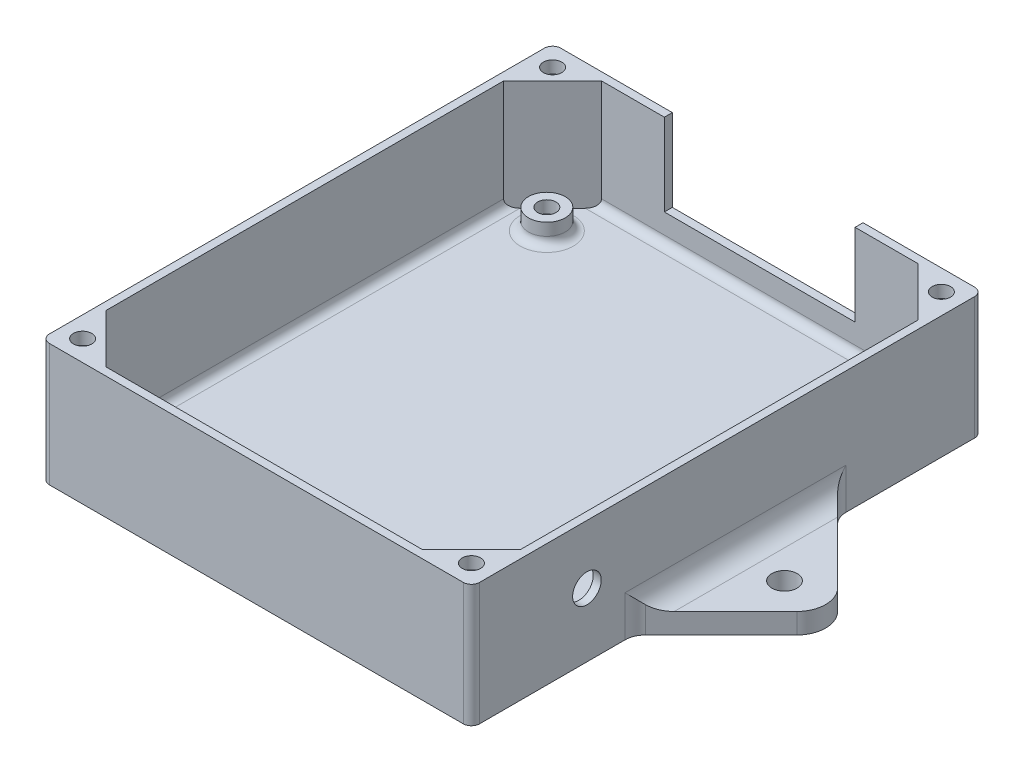
from build123d import *

# Parameters (mm, degrees)
ESQUISSE2_W              = 105.34
ESQUISSE2_H              = 125.21
ESQUISSE2_W_2            = 101.44
ESQUISSE2_H_2            = 121.31
BASE_DEPTH               = 3
ESQUISSE3_R              = 4.5
SUPPORT_PCB_DEPTH        = 5
ESQUISSE4_R              = 2.25
ESQUISSE4_R_2            = 1.5
INSERT_M3_PCB_DEPTH      = 3
ESQUISSE4_3_R            = 1.5
PASSAGE_M3_PCB_DEPTH     = 5
ESQUISSE2_4_W            = 105.34
ESQUISSE2_4_H            = 125.21
ESQUISSE2_4_W_2          = 101.44
ESQUISSE2_4_H_2          = 121.31
WALLS_DEPTH              = 27
OUVERTURE_CONN_CMC_REACH = 140.494
ESQUISSE5_W              = 46.7
ESQUISSE5_H              = 20.1
CHANFREIN1_SIZE          = 12
CONG_1_R                 = 2
ESQUISSE6_R              = 2.25
INSERT_M3_BOX_DEPTH      = 3
ESQUISSE6_3_R            = 1.6
PASSAGE_M3_BOX_DEPTH     = 18
ESQUISSE10_R             = 3.1
BOSS_EXTRU_2_DEPTH       = 5
CONG_4_R                 = 5
PASSAGE_MAP_REACH        = 147.406
ESQUISSE11_R             = 3.5


with BuildPart() as part:
    # Esquisse2 → Base (new body)
    # profile 1 of 2: a face of its own
    with BuildSketch(Plane(origin=(0, 0, 0), x_dir=(1, 0, 0), z_dir=(0, 1, 0))):
        with Locations((0, -2.05)):
            Rectangle(ESQUISSE2_W, ESQUISSE2_H)
        with Locations((0, -2.05)):
            Rectangle(ESQUISSE2_W_2, ESQUISSE2_H_2, mode=Mode.SUBTRACT)
    # profile 2 of 2: a face of its own
    with BuildSketch(Plane(origin=(0, 0, 0), x_dir=(1, 0, 0), z_dir=(0, 1, 0))):
        with Locations((0, -2.05)):
            Rectangle(ESQUISSE2_W_2, ESQUISSE2_H_2)
    extrude(amount=-BASE_DEPTH)

    # Esquisse3 → Support_PCB (add)
    with BuildSketch(Plane(origin=(0, 0, 0), x_dir=(1, 0, 0), z_dir=(0, 1, 0))):
        with Locations(Location((-40.64, 47.117, 0), (0, 0, 270))):
            Circle(ESQUISSE3_R)
        with Locations(Location((40.64, 47.117, 0), (0, 0, 270))):
            Circle(ESQUISSE3_R)
        with Locations(Location((-40.64, -47.117, 0), (0, 0, 90))):
            Circle(ESQUISSE3_R)
        with Locations(Location((40.64, -47.117, 0), (0, 0, 90))):
            Circle(ESQUISSE3_R)
    extrude(amount=SUPPORT_PCB_DEPTH)

    # Esquisse4 → Insert_M3_PCB (cut)
    # profile 1 of 8: a face of its own
    with BuildSketch(Plane(origin=(0, 5, 0), x_dir=(1, 0, 0), z_dir=(0, 1, 0))):
        with Locations(Location((-40.64, 47.117, 0), (0, 0, 270))):
            Circle(ESQUISSE4_R)
        with Locations((-40.64, 47.117)):
            Circle(ESQUISSE4_R_2, mode=Mode.SUBTRACT)
    # profile 2 of 8: a face of its own
    with BuildSketch(Plane(origin=(0, 5, 0), x_dir=(1, 0, 0), z_dir=(0, 1, 0))):
        with Locations((-40.64, 47.117)):
            Circle(ESQUISSE4_R_2)
    # profile 3 of 8: a face of its own
    with BuildSketch(Plane(origin=(0, 5, 0), x_dir=(1, 0, 0), z_dir=(0, 1, 0))):
        with Locations(Location((40.64, 47.117, 0), (0, 0, 270))):
            Circle(ESQUISSE4_R)
        with Locations((40.64, 47.117)):
            Circle(ESQUISSE4_R_2, mode=Mode.SUBTRACT)
    # profile 4 of 8: a face of its own
    with BuildSketch(Plane(origin=(0, 5, 0), x_dir=(1, 0, 0), z_dir=(0, 1, 0))):
        with Locations((40.64, 47.117)):
            Circle(ESQUISSE4_R_2)
    # profile 5 of 8: a face of its own
    with BuildSketch(Plane(origin=(0, 5, 0), x_dir=(1, 0, 0), z_dir=(0, 1, 0))):
        with Locations(Location((40.64, -47.117, 0), (0, 0, 270))):
            Circle(ESQUISSE4_R)
        with Locations((40.64, -47.117)):
            Circle(ESQUISSE4_R_2, mode=Mode.SUBTRACT)
    # profile 6 of 8: a face of its own
    with BuildSketch(Plane(origin=(0, 5, 0), x_dir=(1, 0, 0), z_dir=(0, 1, 0))):
        with Locations((40.64, -47.117)):
            Circle(ESQUISSE4_R_2)
    # profile 7 of 8: a face of its own
    with BuildSketch(Plane(origin=(0, 5, 0), x_dir=(1, 0, 0), z_dir=(0, 1, 0))):
        with Locations(Location((-40.64, -47.117, 0), (0, 0, 270))):
            Circle(ESQUISSE4_R)
        with Locations((-40.64, -47.117)):
            Circle(ESQUISSE4_R_2, mode=Mode.SUBTRACT)
    # profile 8 of 8: a face of its own
    with BuildSketch(Plane(origin=(0, 5, 0), x_dir=(1, 0, 0), z_dir=(0, 1, 0))):
        with Locations((-40.64, -47.117)):
            Circle(ESQUISSE4_R_2)
    extrude(amount=-INSERT_M3_PCB_DEPTH, mode=Mode.SUBTRACT)

    # Esquisse4<3> → Passage M3_PCB (cut)
    with BuildSketch(Plane(origin=(0, 5, 0), x_dir=(1, 0, 0), z_dir=(0, 1, 0))):
        with Locations(Location((-40.64, -47.117, 0), (0, 0, 270))):
            Circle(ESQUISSE4_3_R)
        with Locations(Location((40.64, -47.117, 0), (0, 0, 270))):
            Circle(ESQUISSE4_3_R)
        with Locations(Location((40.64, 47.117, 0), (0, 0, 270))):
            Circle(ESQUISSE4_3_R)
        with Locations(Location((-40.64, 47.117, 0), (0, 0, 270))):
            Circle(ESQUISSE4_3_R)
    extrude(amount=-PASSAGE_M3_PCB_DEPTH, mode=Mode.SUBTRACT)

    # Esquisse2<4> → Walls (add)
    with BuildSketch(Plane(origin=(0, 0, 0), x_dir=(1, 0, 0), z_dir=(0, 1, 0))):
        with Locations((0, -2.05)):
            Rectangle(ESQUISSE2_4_W, ESQUISSE2_4_H)
        with Locations((0, -2.05)):
            Rectangle(ESQUISSE2_4_W_2, ESQUISSE2_4_H_2, mode=Mode.SUBTRACT)
    extrude(amount=WALLS_DEPTH)

    # Esquisse5 → Ouverture_Conn_CMC (cut, up to next)
    with BuildSketch(Plane(origin=(0, 0, -60.555), x_dir=(-1, 0, 0), z_dir=(0, 0, -1)), mode=Mode.PRIVATE) as ouverture_conn_cmc_sk1:
        with Locations((0, 16.95)):
            Rectangle(ESQUISSE5_W, ESQUISSE5_H)
    ouverture_conn_cmc_tool1 = extrude(ouverture_conn_cmc_sk1.sketch, amount=-OUVERTURE_CONN_CMC_REACH, mode=Mode.PRIVATE) & part.part
    add(ouverture_conn_cmc_tool1.solids().sort_by_distance((0, 16.95, -60.555))[0], mode=Mode.SUBTRACT)

    # Chanfrein1
    chanfrein1_edges = [part.edges().sort_by_distance(p)[0] for p in [
        (-50.72, 13.5, -58.605),
        (50.72, 13.5, -58.605),
        (50.72, 13.5, 62.705),
        (-50.72, 13.5, 62.705),
    ]]
    chamfer(chanfrein1_edges, length=CHANFREIN1_SIZE)

    # Congé1
    cong_1_edges = [part.edges().sort_by_distance(p)[0] for p in [
        (0, 0, -58.605),
        (50.72, 0, 2.05),
        (-50.72, 0, 2.05),
        (0, 0, 62.705),
        (-40.64, 0, -51.617),
        (40.64, 0, -51.617),
        (-40.64, 0, 51.617),
        (40.64, 0, 51.617),
        (52.67, 12, -60.555),
        (52.67, 12, 64.655),
        (-52.67, 12, 64.655),
        (-52.67, 12, -60.555),
    ]]
    fillet(cong_1_edges, radius=CONG_1_R)

    # Esquisse6 → Insert_M3_Box (cut)
    with BuildSketch(Plane(origin=(0, 27, 0), x_dir=(1, 0, 0), z_dir=(0, 1, 0))):
        with Locations(Location((-47.598784258, 55.483784258, 0), (0, 0, 270))):
            Circle(ESQUISSE6_R)
        with Locations(Location((-47.598784258, -59.583784258, 0), (0, 0, 270))):
            Circle(ESQUISSE6_R)
        with Locations(Location((47.598784258, 55.483784258, 0), (0, 0, 270))):
            Circle(ESQUISSE6_R)
        with Locations(Location((47.598784258, -59.583784258, 0), (0, 0, 270))):
            Circle(ESQUISSE6_R)
    extrude(amount=-INSERT_M3_BOX_DEPTH, mode=Mode.SUBTRACT)

    # Esquisse6<3> → Passage_M3_Box (cut)
    with BuildSketch(Plane(origin=(0, 27, 0), x_dir=(1, 0, 0), z_dir=(0, 1, 0))):
        with Locations(Location((-47.598784258, 55.483784258, 0), (0, 0, 270))):
            Circle(ESQUISSE6_3_R)
        with Locations(Location((-47.598784258, -59.583784258, 0), (0, 0, 270))):
            Circle(ESQUISSE6_3_R)
        with Locations(Location((47.598784258, 55.483784258, 0), (0, 0, 270))):
            Circle(ESQUISSE6_3_R)
        with Locations(Location((47.598784258, -59.583784258, 0), (0, 0, 270))):
            Circle(ESQUISSE6_3_R)
    extrude(amount=-PASSAGE_M3_BOX_DEPTH, mode=Mode.SUBTRACT)

    # Esquisse10 → Boss.-Extru.2 (add)
    # profile 1 of 2: a face of its own
    with BuildSketch(Plane.XZ.offset(3)):
        with BuildLine():
            Line((52.67, 25), (72.67, 5))
            ThreePointArc((72.67, 5), (74.741067812, 0), (72.67, -5))
            Line((72.67, -5), (52.67, -25))
            Line((52.67, -25), (52.67, 25))
        make_face()
        with Locations(Location((64.67, 0, 0), (0, 0, 270))):
            Circle(ESQUISSE10_R, mode=Mode.SUBTRACT)
    # profile 2 of 2: a face of its own
    with BuildSketch(Plane.XZ.offset(3)):
        with BuildLine():
            Line((-52.67, 25), (-72.67, 5))
            ThreePointArc((-72.67, 5), (-74.741067812, 0), (-72.67, -5))
            Line((-72.67, -5), (-52.67, -25))
            Line((-52.67, -25), (-52.67, 25))
        make_face()
        with Locations(Location((-64.67, 0, 0), (0, 0, 90))):
            Circle(ESQUISSE10_R, mode=Mode.SUBTRACT)
    extrude(amount=-BOSS_EXTRU_2_DEPTH)

    # Congé4
    cong_4_edges = [part.edges().sort_by_distance(p)[0] for p in [
        (52.67, 2, 0),
        (52.67, -0.5, -25),
        (52.67, -0.5, 25),
        (-52.67, 2, 0),
        (-52.67, -0.5, 25),
        (-52.67, -0.5, -25),
    ]]
    fillet(cong_4_edges, radius=CONG_4_R)

    # Esquisse11 → Passage_MAP (cut, up to next)
    with BuildSketch(Plane(origin=(52.67, 0, 0), x_dir=(0, 0, -1), z_dir=(1, 0, 0)), mode=Mode.PRIVATE) as passage_map_sk1:
        with Locations((-36.375, 12.6)):
            Circle(ESQUISSE11_R)
    passage_map_tool1 = extrude(passage_map_sk1.sketch, amount=-PASSAGE_MAP_REACH, mode=Mode.PRIVATE) & part.part
    add(passage_map_tool1.solids().sort_by_distance((52.67, 12.6, 36.375))[0], mode=Mode.SUBTRACT)


solid = part.part
